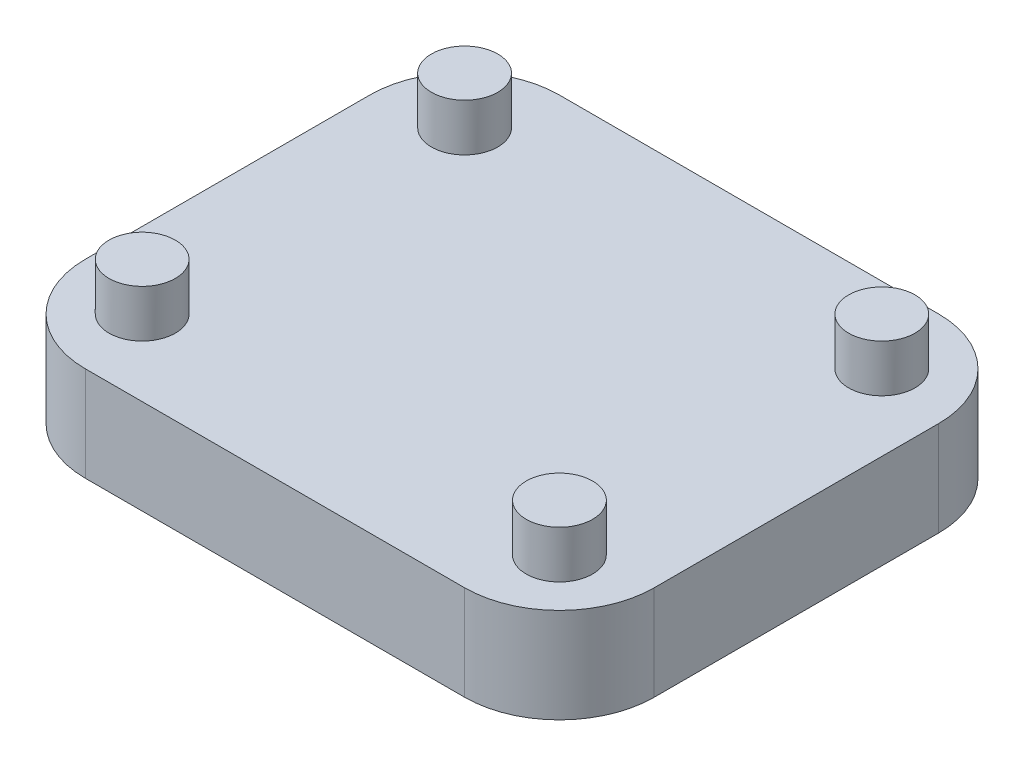
from build123d import *

# Parameters (mm, degrees)
BOSS_EXTRUDE1_DEPTH = 2
SKETCH3_R           = 0.7
BOSS_EXTRUDE3_DEPTH = 1


with BuildPart() as part:
    # Sketch1 → Boss-Extrude1 (new body)
    with BuildSketch(Plane(origin=(0, 0, 0), x_dir=(1, 0, 0), z_dir=(0, 1, 0))):
        with BuildLine():
            Line((-2, 0), (-10, 0))
            ThreePointArc((-10, 0), (-11.414213562, -0.585786438), (-12, -2))
            Line((-12, -2), (-12, -8))
            ThreePointArc((-12, -8), (-11.414213562, -9.414213562), (-10, -10))
            Line((-10, -10), (-2, -10))
            ThreePointArc((-2, -10), (-0.585786438, -9.414213562), (0, -8))
            Line((0, -8), (0, -2))
            ThreePointArc((0, -2), (-0.585786438, -0.585786438), (-2, 0))
        make_face()
    extrude(amount=BOSS_EXTRUDE1_DEPTH)

    # Sketch3 → Boss-Extrude3 (add)
    with BuildSketch(Plane(origin=(0, 2, 0), x_dir=(1, 0, 0), z_dir=(0, 1, 0))):
        with Locations(Location((-10.4, -1.6, 0), (0, 0, 90))):
            Circle(SKETCH3_R)
        with Locations(Location((-1.6, -1.6, 0), (0, 0, 90))):
            Circle(SKETCH3_R)
        with Locations(Location((-1.6, -8.4, 0), (0, 0, 90))):
            Circle(SKETCH3_R)
        with Locations(Location((-10.4, -8.4, 0), (0, 0, 90))):
            Circle(SKETCH3_R)
    extrude(amount=BOSS_EXTRUDE3_DEPTH)


solid = part.part
